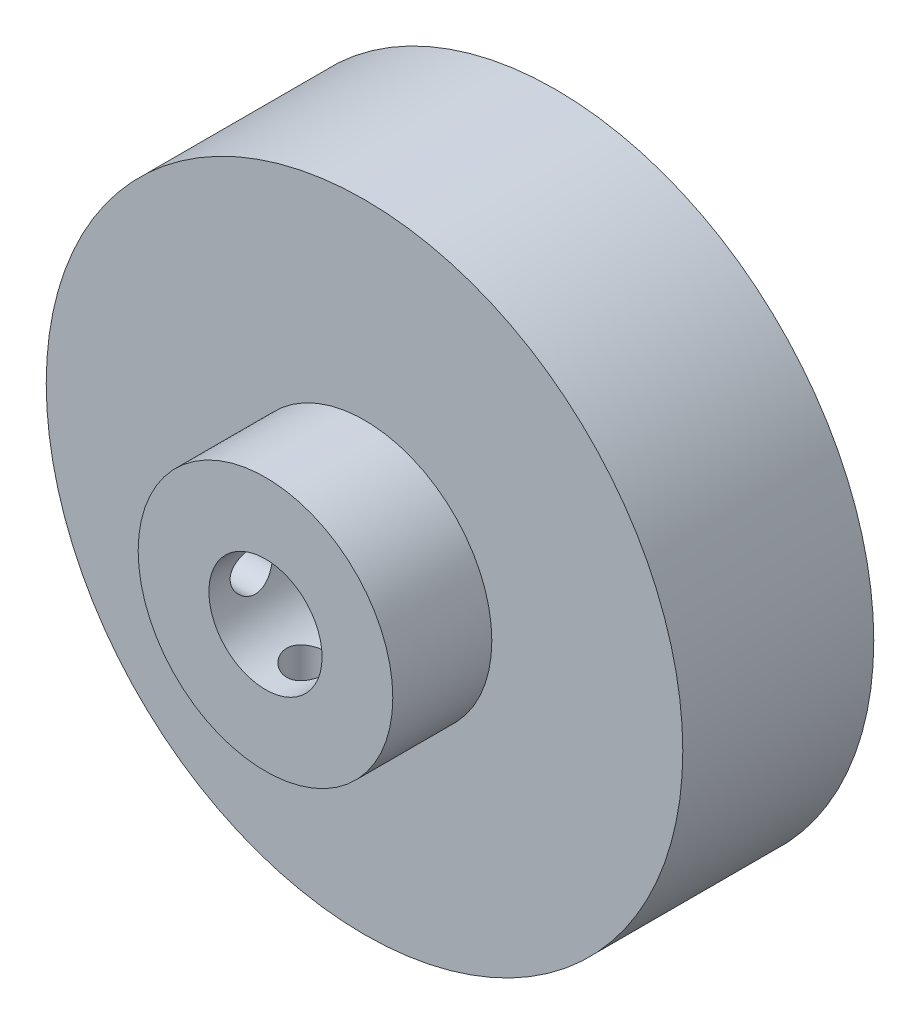
from build123d import *

# Parameters (mm, degrees)
SKETCH_1_R          = 22.5
EXTRUDE_1_DEPTH     = 13.5
SKETCH_2_R          = 9
EXTRUDE_2_DEPTH     = 7
SKETCH_3_R          = 4
CUT_EXTRUDE_1_DEPTH = 38.851684243
SKETCH_4_R          = 1.5
CUT_EXTRUDE_2_DEPTH = 38.851684243
SKETCH_5_R          = 1.5
CUT_EXTRUDE_3_DEPTH = 38.851684297


with BuildPart() as part:
    # 스케치1 → 보스-돌출1 (new body)
    with BuildSketch(Plane.XY):
        Circle(SKETCH_1_R)
    extrude(amount=EXTRUDE_1_DEPTH)

    # 스케치2 → 보스-돌출2 (add)
    with BuildSketch(Plane.XY.offset(13.5)):
        Circle(SKETCH_2_R)
    extrude(amount=EXTRUDE_2_DEPTH)

    # 스케치3 → 컷-돌출1 (cut, through all)
    with BuildSketch(Plane.XY.offset(20.5)):
        Circle(SKETCH_3_R)
    extrude(amount=-CUT_EXTRUDE_1_DEPTH, mode=Mode.SUBTRACT)

    # 스케치4 → 컷-돌출2 (cut, through all)
    with BuildSketch(Plane(origin=(0, 0, 0), x_dir=(1, 0, 0), z_dir=(0, 1, 0))):
        with Locations(Location((0, -17.5, 0), (0, 0, 270))):
            Circle(SKETCH_4_R)
    extrude(amount=-CUT_EXTRUDE_2_DEPTH, mode=Mode.SUBTRACT)

    # 스케치5 → 컷-돌출3 (cut, through all)
    with BuildSketch(Plane(origin=(0, 0, 0), x_dir=(0, 0, -1), z_dir=(1, 0, 0))):
        with Locations((-17.5, 0)):
            Circle(SKETCH_5_R)
    extrude(amount=-CUT_EXTRUDE_3_DEPTH, mode=Mode.SUBTRACT)


solid = part.part
